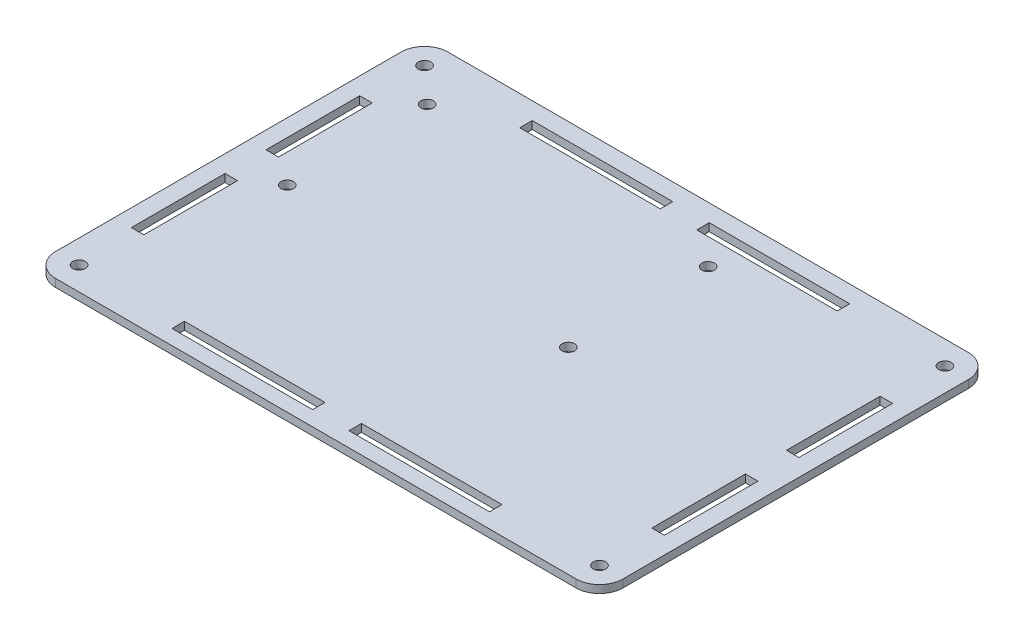
from build123d import *

# Parameters (mm, degrees)
SKETCH1_W           = 145.34
SKETCH1_H           = 100.51
SKETCH1_R           = 1.6
SKETCH1_W_2         = 36
SKETCH1_H_2         = 3.2
SKETCH1_W_3         = 3.2
SKETCH1_H_3         = 24
BOSS_EXTRUDE1_DEPTH = 2
FILLET1_R           = 6
FILLET2_R           = 6
FILLET3_R           = 6


with BuildPart() as part:
    # Sketch1 → Boss-Extrude1 (new body)
    with BuildSketch(Plane(origin=(0, 0, 0), x_dir=(1, 0, 0), z_dir=(0, 1, 0))):
        with Locations((72.67, 50.255)):
            Rectangle(SKETCH1_W, SKETCH1_H)
        with Locations(Location((14.946, 86.224, 0), (0, 0, 270))):
            Circle(SKETCH1_R, mode=Mode.SUBTRACT)
        with Locations(Location((86.952, 86.224, 0), (0, 0, 270))):
            Circle(SKETCH1_R, mode=Mode.SUBTRACT)
        with Locations(Location((86.952, 50.413, 0), (0, 0, 270))):
            Circle(SKETCH1_R, mode=Mode.SUBTRACT)
        with Locations(Location((14.946, 50.413, 0), (0, 0, 270))):
            Circle(SKETCH1_R, mode=Mode.SUBTRACT)
        with Locations(Location((6, 94.51, 0), (0, 0, 270))):
            Circle(SKETCH1_R, mode=Mode.SUBTRACT)
        with Locations(Location((139.34, 94.51, 0), (0, 0, 270))):
            Circle(SKETCH1_R, mode=Mode.SUBTRACT)
        with Locations(Location((139.34, 6, 0), (0, 0, 270))):
            Circle(SKETCH1_R, mode=Mode.SUBTRACT)
        with Locations(Location((6, 6, 0), (0, 0, 270))):
            Circle(SKETCH1_R, mode=Mode.SUBTRACT)
        with Locations((50, 5.414130674)):
            Rectangle(SKETCH1_W_2, SKETCH1_H_2, mode=Mode.SUBTRACT)
        with Locations((50, 94.51)):
            Rectangle(SKETCH1_W_2, SKETCH1_H_2, mode=Mode.SUBTRACT)
        with Locations((95.34, 94.51)):
            Rectangle(SKETCH1_W_2, SKETCH1_H_2, mode=Mode.SUBTRACT)
        with Locations((95.34, 5.414130674)):
            Rectangle(SKETCH1_W_2, SKETCH1_H_2, mode=Mode.SUBTRACT)
        with Locations((6, 67.51)):
            Rectangle(SKETCH1_W_3, SKETCH1_H_3, mode=Mode.SUBTRACT)
        with Locations((6, 33)):
            Rectangle(SKETCH1_W_3, SKETCH1_H_3, mode=Mode.SUBTRACT)
        with Locations((139.34, 67.51)):
            Rectangle(SKETCH1_W_3, SKETCH1_H_3, mode=Mode.SUBTRACT)
        with Locations((139.34, 33)):
            Rectangle(SKETCH1_W_3, SKETCH1_H_3, mode=Mode.SUBTRACT)
    extrude(amount=BOSS_EXTRUDE1_DEPTH)

    # Fillet1
    fillet1_edges = [part.edges().sort_by_distance(p)[0] for p in [
        (0, 1, -100.51),
    ]]
    fillet(fillet1_edges, radius=FILLET1_R)

    # Fillet2
    fillet2_edges = [part.edges().sort_by_distance(p)[0] for p in [
        (0, 1, 0),
    ]]
    fillet(fillet2_edges, radius=FILLET2_R)

    # Fillet3
    fillet3_edges = [part.edges().sort_by_distance(p)[0] for p in [
        (145.34, 1, -100.51),
        (145.34, 1, 0),
    ]]
    fillet(fillet3_edges, radius=FILLET3_R)


solid = part.part
